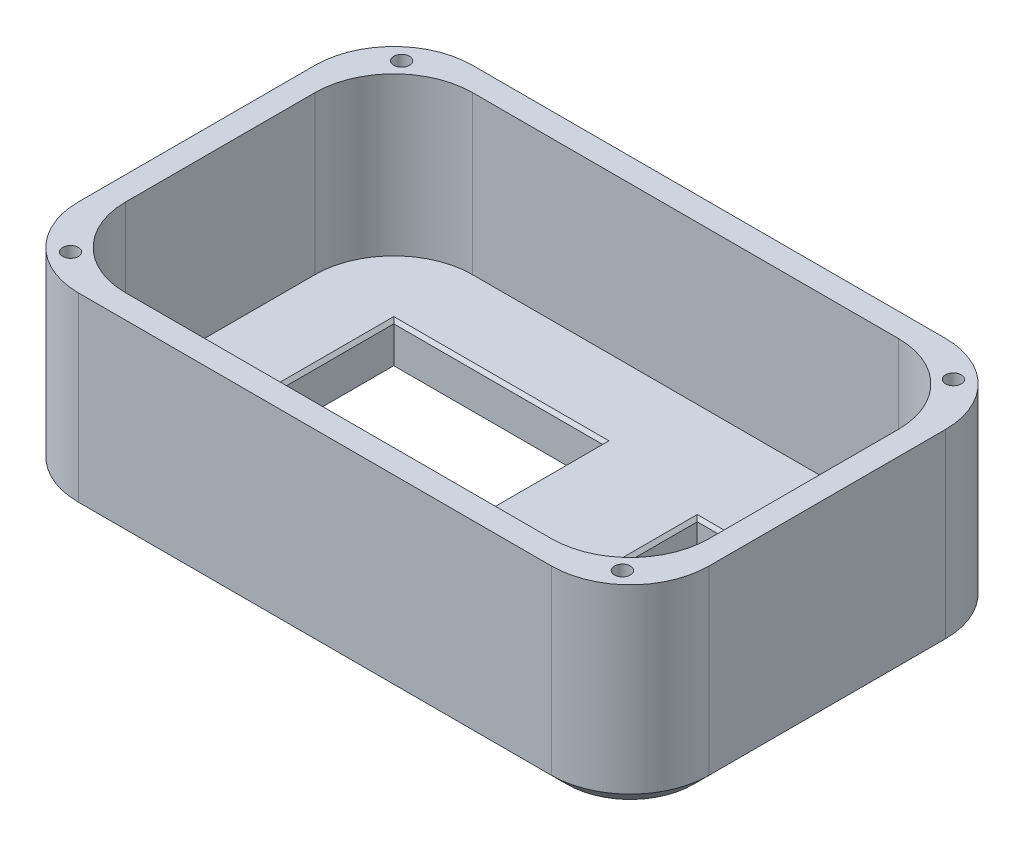
from build123d import *

# Parameters (mm, degrees)
SKETCH1_W           = 80
SKETCH1_H           = 50
BOSS_EXTRUDE1_DEPTH = 25
SKETCH2_W           = 74
SKETCH2_H           = 44
CUT_EXTRUDE1_DEPTH  = 20
SKETCH3_W           = 26.5
SKETCH3_H           = 21
CUT_EXTRUDE2_DEPTH  = 6
SKETCH4_W           = 13
SKETCH4_H           = 16.5
CUT_EXTRUDE3_DEPTH  = 6
FILLET1_R           = 10
SKETCH5_W           = 0.522382479
SKETCH5_H           = 4.253685898
CUT_EXTRUDE4_DEPTH  = 1
CHAMFER1_SIZE       = 2
FILLET2_R           = 10
CHAMFER2_SIZE       = 0.4
SKETCH6_R           = 1
CUT_EXTRUDE5_DEPTH  = 5


with BuildPart() as part:
    # Sketch1 → Boss-Extrude1 (new body)
    with BuildSketch(Plane(origin=(0, 0, 0), x_dir=(1, 0, 0), z_dir=(0, 1, 0))):
        Rectangle(SKETCH1_W, SKETCH1_H)
    extrude(amount=BOSS_EXTRUDE1_DEPTH)

    # Sketch2 → Cut-Extrude1 (cut)
    with BuildSketch(Plane(origin=(0, 25, 0), x_dir=(1, 0, 0), z_dir=(0, 1, 0))):
        Rectangle(SKETCH2_W, SKETCH2_H)
    extrude(amount=-CUT_EXTRUDE1_DEPTH, mode=Mode.SUBTRACT)

    # Sketch3 → Cut-Extrude2 (cut)
    with BuildSketch(Plane(origin=(0, 5, 0), x_dir=(1, 0, 0), z_dir=(0, 1, 0))):
        with Locations((-13.75, 1.5)):
            Rectangle(SKETCH3_W, SKETCH3_H)
    extrude(amount=-CUT_EXTRUDE2_DEPTH, mode=Mode.SUBTRACT)

    # Sketch4 → Cut-Extrude3 (cut)
    with BuildSketch(Plane(origin=(0, 5, 0), x_dir=(1, 0, 0), z_dir=(0, 1, 0))):
        with Locations((20.5, 1.25)):
            Rectangle(SKETCH4_W, SKETCH4_H)
    extrude(amount=-CUT_EXTRUDE3_DEPTH, mode=Mode.SUBTRACT)

    # Fillet1
    fillet1_edges = [part.edges().sort_by_distance(p)[0] for p in [
        (40, 12.5, 25),
        (-40, 12.5, 25),
        (-40, 12.5, -25),
        (40, 12.5, -25),
    ]]
    fillet(fillet1_edges, radius=FILLET1_R)

    # Sketch5 → Cut-Extrude4 (cut)
    # profile 1 of 15: a face of its own
    with BuildSketch(Plane.XZ):
        Polygon((-34.585413701, 19.199517843), (-34.04670677, 19.199517843), (-32.906327163, 14.927175428), (-31.213248237, 19.199517843), (-31.137456136, 19.199517843), (-29.473528018, 14.959824333), (-28.328484281, 19.199517843), (-27.794441479, 19.199517843), (-29.36392098, 13.378684509), (-29.438547048, 13.378684509), (-31.18992759, 17.828263836), (-32.95996465, 13.378684509), (-33.03575675, 13.378684509), align=None)
    # profile 2 of 15: a face of its own
    with BuildSketch(Plane.XZ):
        with BuildLine():
            Line((-23.407827897, 14.72195374), (-22.943747035, 14.478252986))
            add(Edge.make_bspline(
                [(-22.943747035, 14.478252986), (-22.98072861, 14.412654969), (-23.052680112, 14.285027207), (-23.176415641, 14.109683981), (-23.306123886, 13.951943197), (-23.44765989, 13.816018998), (-23.596789106, 13.697521159), (-23.754338533, 13.59384742), (-23.921128388, 13.505506261), (-24.097166561, 13.431078545), (-24.28393141, 13.37385228), (-24.481875527, 13.333432045), (-24.691378121, 13.308446919), (-24.834980042, 13.305544584), (-24.908511491, 13.304058441)],
                knots=[0, 0, 0, 0, 1.120438281, 2.179929193, 3.190490725, 4.156257408, 5.095198341, 6.022838206, 6.959905092, 7.901321166, 8.864066838, 9.862729781, 10.905609505, 12, 12, 12, 12], degree=3))
            add(Edge.make_bspline(
                [(-24.908511491, 13.304058441), (-24.99023928, 13.305966303), (-25.149666519, 13.309687989), (-25.381734408, 13.341773194), (-25.600230893, 13.394114724), (-25.80514369, 13.467233607), (-25.995970984, 13.562740716), (-26.173092049, 13.679089997), (-26.337438332, 13.815683759), (-26.483830975, 13.973705154), (-26.615621099, 14.142811933), (-26.731914397, 14.319026659), (-26.829134672, 14.501905974), (-26.908219192, 14.690285644), (-26.97209014, 14.882978333), (-27.016605718, 15.081737286), (-27.042266858, 15.286024561), (-27.046199156, 15.424223344), (-27.048180795, 15.493867135)],
                knots=[0, 0, 0, 0, 1.145258523, 2.234067595, 3.276747158, 4.290159414, 5.277019952, 6.260822364, 7.254936242, 8.264827045, 9.274100331, 10.257902744, 11.220704747, 12.172965371, 13.118907548, 14.062713208, 15.023725156, 16, 16, 16, 16], degree=3))
            add(Edge.make_bspline(
                [(-27.048180795, 15.493867135), (-27.046419342, 15.55921818), (-27.042928375, 15.688735322), (-27.020924316, 15.8804329), (-26.981927571, 16.066746886), (-26.92841528, 16.247832093), (-26.859311601, 16.423385323), (-26.774772779, 16.593513419), (-26.674667122, 16.758035348), (-26.59737864, 16.861817703), (-26.558447222, 16.914094499)],
                knots=[0, 0, 0, 0, 1.024358464, 2.0301432, 3.019427413, 4.004406732, 4.986367066, 5.972626655, 6.978780325, 8, 8, 8, 8], degree=3))
            add(Edge.make_bspline(
                [(-26.558447222, 16.914094499), (-26.505714325, 16.977074036), (-26.401918977, 17.101038079), (-26.226368705, 17.263918843), (-26.036276593, 17.400365454), (-25.834024877, 17.513467799), (-25.617262907, 17.599405995), (-25.388904479, 17.663447772), (-25.146349379, 17.699334059), (-24.980530101, 17.704402897), (-24.895685136, 17.706996475)],
                knots=[0, 0, 0, 0, 1.030682036, 2.02871468, 2.997146059, 3.962720338, 4.930598197, 5.918074684, 6.934738563, 8, 8, 8, 8], degree=3))
            add(Edge.make_bspline(
                [(-24.895685136, 17.706996475), (-24.808459773, 17.704744563), (-24.637343495, 17.700326824), (-24.387825789, 17.659370887), (-24.151731597, 17.594422769), (-23.929155397, 17.502696763), (-23.720074621, 17.384351651), (-23.525848298, 17.237763374), (-23.343154771, 17.067432341), (-23.236868718, 16.936441622), (-23.18278366, 16.869785271)],
                knots=[0, 0, 0, 0, 1.056321875, 2.072262726, 3.055038591, 4.01806755, 4.982017516, 5.957941055, 6.960871419, 8, 8, 8, 8], degree=3))
            add(Edge.make_bspline(
                [(-23.18278366, 16.869785271), (-23.145984454, 16.819553838), (-23.072630989, 16.719425329), (-22.9807498, 16.556157345), (-22.900992085, 16.385339845), (-22.83724072, 16.204211648), (-22.785619073, 16.014918846), (-22.748271245, 15.81610821), (-22.726368915, 15.60783894), (-22.722063665, 15.465932752), (-22.71986883, 15.393588356)],
                knots=[0, 0, 0, 0, 0.94817472, 1.890038105, 2.849395472, 3.817997239, 4.812318967, 5.836947057, 6.897266129, 8, 8, 8, 8], degree=3))
            Line((-22.71986883, 15.393588356), (-26.525798317, 15.393588356))
            add(Edge.make_bspline(
                [(-26.525798317, 15.393588356), (-26.523237805, 15.337541274), (-26.518202661, 15.227326948), (-26.494727833, 15.066055301), (-26.457726004, 14.912429635), (-26.405722575, 14.767602243), (-26.342746404, 14.629681543), (-26.26560254, 14.499690631), (-26.173567591, 14.378221598), (-26.070911874, 14.264187918), (-25.956645431, 14.162638057), (-25.836432339, 14.071746948), (-25.708551017, 13.995567878), (-25.574009799, 13.93373418), (-25.433026247, 13.885327605), (-25.285555942, 13.852285527), (-25.131889074, 13.830154541), (-25.0271378, 13.827693716), (-24.973809301, 13.82644092)],
                knots=[0, 0, 0, 0, 1.094153842, 2.151609401, 3.174256925, 4.172055639, 5.149267565, 6.128595816, 7.11444997, 8.118368179, 9.117203808, 10.09244225, 11.054858984, 12.015122123, 12.976791628, 13.957293641, 14.960065497, 16, 16, 16, 16], degree=3))
            add(Edge.make_bspline(
                [(-24.973809301, 13.82644092), (-24.921669357, 13.827452176), (-24.818213705, 13.829458702), (-24.664143137, 13.848969987), (-24.512569422, 13.880519362), (-24.364119906, 13.923576881), (-24.22180744, 13.976092194), (-24.090014543, 14.039460875), (-23.968807803, 14.109559918), (-23.855522801, 14.189737199), (-23.745640446, 14.287873434), (-23.636637049, 14.410336651), (-23.519760282, 14.555171504), (-23.446601399, 14.664180188), (-23.407827897, 14.72195374)],
                knots=[0, 0, 0, 0, 0.99110716, 1.966546729, 2.947904876, 3.932708344, 4.903319531, 5.828989031, 6.710028674, 7.56322171, 8.463672341, 9.504779593, 10.677557249, 12, 12, 12, 12], degree=3))
        make_face()
        with BuildLine():
            add(Edge.make_bspline(
                [(-23.242251308, 15.915970834), (-23.26137129, 15.985260161), (-23.298171099, 16.118619811), (-23.375066577, 16.303291387), (-23.461666508, 16.467418765), (-23.564149316, 16.609745846), (-23.680264506, 16.736146926), (-23.814385126, 16.846607359), (-23.96478863, 16.945424239), (-24.130697581, 17.028832622), (-24.306389931, 17.099829923), (-24.490338562, 17.147436216), (-24.678031812, 17.180048753), (-24.804983, 17.183085745), (-24.868866392, 17.184613997)],
                knots=[0, 0, 0, 0, 1.154881502, 2.222775134, 3.210006277, 4.132804581, 5.035138423, 5.962687519, 6.919655026, 7.923214229, 8.944639381, 9.960483929, 10.97369054, 12, 12, 12, 12], degree=3))
            add(Edge.make_bspline(
                [(-24.868866392, 17.184613997), (-24.921003494, 17.183596729), (-25.024067583, 17.181585804), (-25.175909955, 17.162509886), (-25.321729645, 17.130977858), (-25.462602605, 17.087795663), (-25.596682788, 17.030238261), (-25.726728134, 16.96274449), (-25.84943196, 16.880352118), (-25.926169329, 16.817555546), (-25.964936772, 16.785830944)],
                knots=[0, 0, 0, 0, 1.04873581, 2.073130211, 3.073294108, 4.04793562, 5.032784715, 6.005352987, 6.992311501, 8, 8, 8, 8], degree=3))
            add(Edge.make_bspline(
                [(-25.964936772, 16.785830944), (-25.992699289, 16.760727659), (-26.048883859, 16.70992473), (-26.123956845, 16.622397347), (-26.195836608, 16.528014094), (-26.261252218, 16.423164048), (-26.32125268, 16.309041157), (-26.377398738, 16.186608018), (-26.427934235, 16.054935562), (-26.456366694, 15.963178541), (-26.470994798, 15.915970834)],
                knots=[0, 0, 0, 0, 0.879870761, 1.780643979, 2.707998968, 3.669668524, 4.684282772, 5.740141944, 6.837334558, 8, 8, 8, 8], degree=3))
            Line((-26.470994798, 15.915970834), (-23.242251308, 15.915970834))
        make_face(mode=Mode.SUBTRACT)
    # profile 3 of 15: a face of its own
    with BuildSketch(Plane.XZ):
        with BuildLine():
            Line((-17.346791906, 17.632370407), (-17.346791906, 13.378684509))
            Line((-17.346791906, 13.378684509), (-17.869174385, 13.378684509))
            Line((-17.869174385, 13.378684509), (-17.869174385, 14.114450902))
            add(Edge.make_bspline(
                [(-17.869174385, 14.114450902), (-17.928079207, 14.047861244), (-18.043032708, 13.917910689), (-18.235022282, 13.748138314), (-18.438532216, 13.60780913), (-18.65257477, 13.494469329), (-18.876956658, 13.409332064), (-19.111180484, 13.348818416), (-19.355341792, 13.30991224), (-19.522071006, 13.306027213), (-19.606562539, 13.304058441)],
                knots=[0, 0, 0, 0, 1.074387032, 2.096679803, 3.090159297, 4.057316773, 5.018401886, 5.985159533, 6.978961417, 8, 8, 8, 8], degree=3))
            add(Edge.make_bspline(
                [(-19.606562539, 13.304058441), (-19.681681148, 13.306098015), (-19.829818371, 13.310120145), (-20.047732206, 13.341323643), (-20.257435625, 13.391433736), (-20.459126789, 13.461118906), (-20.651500584, 13.553555106), (-20.836204102, 13.664219538), (-21.012280472, 13.796004586), (-21.177045876, 13.946661104), (-21.328773382, 14.110301339), (-21.461922903, 14.284835778), (-21.572939632, 14.469509705), (-21.665773743, 14.661984962), (-21.737280758, 14.863743227), (-21.787129767, 15.074086803), (-21.818296914, 15.292766985), (-21.822317382, 15.44167974), (-21.824356009, 15.517187781)],
                knots=[0, 0, 0, 0, 1.033919861, 2.038935746, 3.024066025, 3.998881131, 4.97069526, 5.957263378, 6.95902576, 7.993208707, 9.027059324, 10.027763471, 11.009749337, 11.988697705, 12.965288445, 13.950418724, 14.960734635, 16, 16, 16, 16], degree=3))
            add(Edge.make_bspline(
                [(-21.824356009, 15.517187781), (-21.822272198, 15.591135155), (-21.818152617, 15.737325124), (-21.787463155, 15.952327911), (-21.735855632, 16.159413637), (-21.663431414, 16.357915601), (-21.570560925, 16.548073994), (-21.457590047, 16.730023307), (-21.324510621, 16.904264793), (-21.171086083, 17.066701345), (-21.004885042, 17.216746819), (-20.827085641, 17.347148529), (-20.642110731, 17.459768098), (-20.447091177, 17.548998939), (-20.244913504, 17.621192414), (-20.033777833, 17.6711401), (-19.814562624, 17.700572431), (-19.665731413, 17.704834552), (-19.590238087, 17.706996475)],
                knots=[0, 0, 0, 0, 1.020392517, 2.01726096, 2.990465484, 3.961182959, 4.928053699, 5.906110375, 6.912531644, 7.948652711, 8.985773172, 9.998621852, 10.987621588, 11.969261332, 12.953316658, 13.946091881, 14.958173133, 16, 16, 16, 16], degree=3))
            add(Edge.make_bspline(
                [(-19.590238087, 17.706996475), (-19.50342475, 17.704605357), (-19.333187893, 17.699916488), (-19.084175954, 17.660895738), (-18.848607697, 17.594973192), (-18.624664686, 17.505303258), (-18.413151092, 17.386144598), (-18.216069343, 17.235834115), (-18.031356867, 17.055319784), (-17.924286311, 16.916666795), (-17.869174385, 16.845298592)],
                knots=[0, 0, 0, 0, 1.038897134, 2.037228247, 3.008116434, 3.962042015, 4.918381754, 5.904844433, 6.921570401, 8, 8, 8, 8], degree=3))
            Line((-17.869174385, 16.845298592), (-17.869174385, 17.632370407))
            Line((-17.869174385, 17.632370407), (-17.346791906, 17.632370407))
        make_face()
        with BuildLine():
            add(Edge.make_bspline(
                [(-19.583241893, 17.184613997), (-19.65960181, 17.181897101), (-19.81032414, 17.176534383), (-20.031588986, 17.134668463), (-20.243323319, 17.065010393), (-20.444468159, 16.969745136), (-20.631846133, 16.849954487), (-20.799309298, 16.70506333), (-20.948227338, 16.539024867), (-21.073472154, 16.352588381), (-21.175570397, 16.15272077), (-21.247361282, 15.943795365), (-21.294708352, 15.72958042), (-21.299545499, 15.584287954), (-21.30197353, 15.51135762)],
                knots=[0, 0, 0, 0, 1.031046209, 2.035121221, 3.029706178, 4.034933723, 5.034054252, 6.02443088, 7.017295772, 8.038157696, 9.050218397, 10.03989886, 11.016116709, 12, 12, 12, 12], degree=3))
            add(Edge.make_bspline(
                [(-21.30197353, 15.51135762), (-21.298872035, 15.43886312), (-21.292681202, 15.294158275), (-21.248192249, 15.079651292), (-21.173552745, 14.870676653), (-21.071701363, 14.669008072), (-20.944164202, 14.481769991), (-20.796333907, 14.312566477), (-20.62678088, 14.16706296), (-20.438971681, 14.0452619), (-20.238389139, 13.946868993), (-20.027452232, 13.878406614), (-19.8101262, 13.834205233), (-19.662356307, 13.829042193), (-19.587906022, 13.82644092)],
                knots=[0, 0, 0, 0, 0.979072187, 1.954306742, 2.945804271, 3.96968567, 4.997920485, 5.998718438, 6.996577872, 8.005894225, 9.015743152, 10.005417472, 10.995077863, 12, 12, 12, 12], degree=3))
            add(Edge.make_bspline(
                [(-19.587906022, 13.82644092), (-19.51232416, 13.829201598), (-19.361999332, 13.834692313), (-19.140078053, 13.876737465), (-18.924715597, 13.946202954), (-18.718845647, 14.042494716), (-18.527063938, 14.161834033), (-18.354937111, 14.301545826), (-18.20938972, 14.464035526), (-18.086000345, 14.642612794), (-17.989249086, 14.838379055), (-17.918773664, 15.046821751), (-17.877106632, 15.267948138), (-17.871855027, 15.419063502), (-17.869174385, 15.4961992)],
                knots=[0, 0, 0, 0, 1.01762866, 2.023962475, 3.030623092, 4.058876274, 5.077231937, 6.066672613, 7.034107872, 8.005628644, 8.981990164, 9.965428785, 10.961468474, 12, 12, 12, 12], degree=3))
            add(Edge.make_bspline(
                [(-17.869174385, 15.4961992), (-17.870770385, 15.554969377), (-17.873911818, 15.670647685), (-17.897911229, 15.840495473), (-17.936087458, 16.003035968), (-17.98988222, 16.158440059), (-18.060549272, 16.305848531), (-18.145779188, 16.446319808), (-18.247070751, 16.579123304), (-18.362793402, 16.702430292), (-18.489463387, 16.814899539), (-18.623499784, 16.915291021), (-18.766490629, 16.997761873), (-18.916031225, 17.066017416), (-19.072381027, 17.120332692), (-19.236812284, 17.156567702), (-19.407577219, 17.181448141), (-19.52407048, 17.1835476), (-19.583241893, 17.184613997)],
                knots=[0, 0, 0, 0, 1.050140795, 2.067009409, 3.05949893, 4.030605086, 5.00011959, 5.97591094, 6.962425594, 7.979863591, 8.993523472, 9.986985069, 10.967611495, 11.937549037, 12.921786183, 13.919465291, 14.943216303, 16, 16, 16, 16], degree=3))
        make_face(mode=Mode.SUBTRACT)
    # profile 4 of 15: a face of its own
    with BuildSketch(Plane.XZ):
        Polygon((-15.630392334, 19.34876998), (-15.108009855, 19.34876998), (-15.108009855, 17.632370407), (-14.361749171, 17.632370407), (-14.361749171, 17.109987928), (-15.108009855, 17.109987928), (-15.108009855, 13.378684509), (-15.630392334, 13.378684509), (-15.630392334, 17.109987928), (-16.376653018, 17.109987928), (-16.376653018, 17.632370407), (-15.630392334, 17.632370407), align=None)
    # profile 5 of 15: a face of its own
    with BuildSketch(Plane.XZ):
        with BuildLine():
            Line((-13.466236351, 19.34876998), (-12.943853872, 19.34876998))
            Line((-12.943853872, 19.34876998), (-12.943853872, 16.82897414))
            add(Edge.make_bspline(
                [(-12.943853872, 16.82897414), (-12.887778788, 16.899063595), (-12.778597727, 17.035531358), (-12.594832162, 17.213584314), (-12.406119294, 17.367917259), (-12.205941152, 17.490770865), (-11.997970227, 17.587823354), (-11.781329381, 17.656654952), (-11.555978361, 17.69898255), (-11.402931772, 17.704301823), (-11.325401014, 17.706996475)],
                knots=[0, 0, 0, 0, 1.125788106, 2.19196713, 3.20547328, 4.180437432, 5.132270164, 6.079753143, 7.027236121, 8, 8, 8, 8], degree=3))
            add(Edge.make_bspline(
                [(-11.325401014, 17.706996475), (-11.246686063, 17.704093658), (-11.092621917, 17.698412146), (-10.868301199, 17.653486321), (-10.658816268, 17.576722105), (-10.46478986, 17.471669326), (-10.290456406, 17.340828922), (-10.136038405, 17.189767449), (-10.009907934, 17.014686897), (-9.924093688, 16.852940485), (-9.868257913, 16.709018295), (-9.832914102, 16.585555905), (-9.802946459, 16.447981485), (-9.776836303, 16.296365853), (-9.75943437, 16.129981205), (-9.74545669, 15.949578189), (-9.735517278, 15.755167148), (-9.735132097, 15.620589067), (-9.734932932, 15.551002719)],
                knots=[0, 0, 0, 0, 1.235656852, 2.418478516, 3.575258207, 4.727955599, 5.870717718, 6.98870536, 8.107142894, 9.245821548, 9.854588956, 10.528768408, 11.260415777, 12.065282286, 12.943670737, 13.886611085, 14.907229059, 16, 16, 16, 16], degree=3))
            Line((-9.734932932, 15.551002719), (-9.734932932, 13.378684509))
            Line((-9.734932932, 13.378684509), (-10.257315411, 13.378684509))
            Line((-10.257315411, 13.378684509), (-10.257315411, 15.379595968))
            add(Edge.make_bspline(
                [(-10.257315411, 15.379595968), (-10.257631903, 15.437509384), (-10.258237299, 15.548287892), (-10.260238576, 15.706890813), (-10.264706007, 15.850742122), (-10.271925214, 15.979380796), (-10.279517755, 16.092986172), (-10.28996751, 16.19139327), (-10.302125125, 16.274737252), (-10.313049635, 16.324903902), (-10.317949091, 16.347402792)],
                knots=[0, 0, 0, 0, 1.430932559, 2.737130458, 3.918967929, 4.986496826, 5.920444988, 6.731744033, 7.431208747, 8, 8, 8, 8], degree=3))
            add(Edge.make_bspline(
                [(-10.317949091, 16.347402792), (-10.336948699, 16.413418133), (-10.373475334, 16.540332241), (-10.458372982, 16.712732702), (-10.564410289, 16.859724943), (-10.693877699, 16.979325253), (-10.844484884, 17.073143016), (-11.017213895, 17.138116458), (-11.210439066, 17.178442729), (-11.346565859, 17.182499523), (-11.417517568, 17.184613997)],
                knots=[0, 0, 0, 0, 1.090059168, 2.095632401, 3.037101401, 3.955032261, 4.878929692, 5.839099886, 6.873700383, 8, 8, 8, 8], degree=3))
            add(Edge.make_bspline(
                [(-11.417517568, 17.184613997), (-11.459540281, 17.183822652), (-11.542702145, 17.182256602), (-11.666018438, 17.166533868), (-11.785643321, 17.140841178), (-11.902728847, 17.106074939), (-12.014793523, 17.058767303), (-12.125103844, 17.004001262), (-12.230534451, 16.936964795), (-12.33295753, 16.861750036), (-12.428282047, 16.778479257), (-12.516970118, 16.690589738), (-12.596030905, 16.596999113), (-12.667658074, 16.49920892), (-12.729489104, 16.39587783), (-12.78346167, 16.288002291), (-12.829256156, 16.175440437), (-12.852011776, 16.097316436), (-12.863397642, 16.058226777)],
                knots=[0, 0, 0, 0, 1.024319606, 2.027102035, 3.025350316, 4.005802111, 5.00026367, 5.987881639, 7.005602596, 8.042517216, 9.083927026, 10.089214625, 11.084353441, 12.06828073, 13.041928858, 14.016821737, 15.00770877, 16, 16, 16, 16], degree=3))
            add(Edge.make_bspline(
                [(-12.863397642, 16.058226777), (-12.869949285, 16.029919315), (-12.884226121, 15.96823387), (-12.899717576, 15.866495143), (-12.913584126, 15.748271736), (-12.925306535, 15.613742964), (-12.932496239, 15.462415862), (-12.940243337, 15.295323089), (-12.943127168, 15.111417983), (-12.943604398, 14.98353343), (-12.943853872, 14.916681137)],
                knots=[0, 0, 0, 0, 0.607992626, 1.324890765, 2.152360218, 3.099583803, 4.150613268, 5.323148443, 6.60066238, 8, 8, 8, 8], degree=3))
            Line((-12.943853872, 14.916681137), (-12.943853872, 13.378684509))
            Line((-12.943853872, 13.378684509), (-13.466236351, 13.378684509))
            Line((-13.466236351, 13.378684509), (-13.466236351, 19.34876998))
        make_face()
    # profile 6 of 15: a face of its own
    with BuildSketch(Plane.XZ):
        with BuildLine():
            Line((-5.049815077, 14.72195374), (-4.585734214, 14.478252986))
            add(Edge.make_bspline(
                [(-4.585734214, 14.478252986), (-4.62271579, 14.412654969), (-4.694667291, 14.285027207), (-4.818402821, 14.109683981), (-4.948111065, 13.951943197), (-5.089647069, 13.816018998), (-5.238776285, 13.697521159), (-5.396325712, 13.59384742), (-5.563115567, 13.505506261), (-5.739153741, 13.431078545), (-5.925918589, 13.37385228), (-6.123862707, 13.333432045), (-6.333365301, 13.308446919), (-6.476967221, 13.305544584), (-6.550498671, 13.304058441)],
                knots=[0, 0, 0, 0, 1.120438281, 2.179929193, 3.190490725, 4.156257408, 5.095198341, 6.022838206, 6.959905092, 7.901321166, 8.864066838, 9.862729781, 10.905609505, 12, 12, 12, 12], degree=3))
            add(Edge.make_bspline(
                [(-6.550498671, 13.304058441), (-6.632226459, 13.305966303), (-6.791653699, 13.309687989), (-7.023721588, 13.341773194), (-7.242218073, 13.394114724), (-7.44713087, 13.467233607), (-7.637958164, 13.562740716), (-7.815079228, 13.679089997), (-7.979425511, 13.815683759), (-8.125818154, 13.973705154), (-8.257608278, 14.142811933), (-8.373901577, 14.319026659), (-8.471121852, 14.501905974), (-8.550206371, 14.690285644), (-8.614077319, 14.882978333), (-8.658592897, 15.081737286), (-8.684254037, 15.286024561), (-8.688186335, 15.424223344), (-8.690167975, 15.493867135)],
                knots=[0, 0, 0, 0, 1.145258523, 2.234067595, 3.276747158, 4.290159414, 5.277019952, 6.260822364, 7.254936242, 8.264827045, 9.274100331, 10.257902744, 11.220704747, 12.172965371, 13.118907548, 14.062713208, 15.023725156, 16, 16, 16, 16], degree=3))
            add(Edge.make_bspline(
                [(-8.690167975, 15.493867135), (-8.688406522, 15.55921818), (-8.684915555, 15.688735322), (-8.662911495, 15.8804329), (-8.623914751, 16.066746886), (-8.57040246, 16.247832093), (-8.50129878, 16.423385323), (-8.416759958, 16.593513419), (-8.316654301, 16.758035348), (-8.239365819, 16.861817703), (-8.200434401, 16.914094499)],
                knots=[0, 0, 0, 0, 1.024358464, 2.0301432, 3.019427413, 4.004406732, 4.986367066, 5.972626655, 6.978780325, 8, 8, 8, 8], degree=3))
            add(Edge.make_bspline(
                [(-8.200434401, 16.914094499), (-8.147701505, 16.977074036), (-8.043906157, 17.101038079), (-7.868355885, 17.263918843), (-7.678263773, 17.400365454), (-7.476012056, 17.513467799), (-7.259250087, 17.599405995), (-7.030891659, 17.663447772), (-6.788336559, 17.699334059), (-6.622517281, 17.704402897), (-6.537672315, 17.706996475)],
                knots=[0, 0, 0, 0, 1.030682036, 2.02871468, 2.997146059, 3.962720338, 4.930598197, 5.918074684, 6.934738563, 8, 8, 8, 8], degree=3))
            add(Edge.make_bspline(
                [(-6.537672315, 17.706996475), (-6.450446952, 17.704744563), (-6.279330674, 17.700326824), (-6.029812968, 17.659370887), (-5.793718777, 17.594422769), (-5.571142576, 17.502696763), (-5.362061801, 17.384351651), (-5.167835478, 17.237763374), (-4.98514195, 17.067432341), (-4.878855897, 16.936441622), (-4.824770839, 16.869785271)],
                knots=[0, 0, 0, 0, 1.056321875, 2.072262726, 3.055038591, 4.01806755, 4.982017516, 5.957941055, 6.960871419, 8, 8, 8, 8], degree=3))
            add(Edge.make_bspline(
                [(-4.824770839, 16.869785271), (-4.787971634, 16.819553838), (-4.714618169, 16.719425329), (-4.62273698, 16.556157345), (-4.542979265, 16.385339845), (-4.4792279, 16.204211648), (-4.427606253, 16.014918846), (-4.390258425, 15.81610821), (-4.368356095, 15.60783894), (-4.364050844, 15.465932752), (-4.361856009, 15.393588356)],
                knots=[0, 0, 0, 0, 0.94817472, 1.890038105, 2.849395472, 3.817997239, 4.812318967, 5.836947057, 6.897266129, 8, 8, 8, 8], degree=3))
            Line((-4.361856009, 15.393588356), (-8.167785496, 15.393588356))
            add(Edge.make_bspline(
                [(-8.167785496, 15.393588356), (-8.165224984, 15.337541274), (-8.16018984, 15.227326948), (-8.136715013, 15.066055301), (-8.099713183, 14.912429635), (-8.047709754, 14.767602243), (-7.984733584, 14.629681543), (-7.907589719, 14.499690631), (-7.815554771, 14.378221598), (-7.712899054, 14.264187918), (-7.598632611, 14.162638057), (-7.478419518, 14.071746948), (-7.350538196, 13.995567878), (-7.215996979, 13.93373418), (-7.075013427, 13.885327605), (-6.927543121, 13.852285527), (-6.773876254, 13.830154541), (-6.66912498, 13.827693716), (-6.61579648, 13.82644092)],
                knots=[0, 0, 0, 0, 1.094153842, 2.151609401, 3.174256925, 4.172055639, 5.149267565, 6.128595816, 7.11444997, 8.118368179, 9.117203808, 10.09244225, 11.054858984, 12.015122123, 12.976791628, 13.957293641, 14.960065497, 16, 16, 16, 16], degree=3))
            add(Edge.make_bspline(
                [(-6.61579648, 13.82644092), (-6.563656536, 13.827452176), (-6.460200885, 13.829458702), (-6.306130316, 13.848969987), (-6.154556602, 13.880519362), (-6.006107086, 13.923576881), (-5.863794619, 13.976092194), (-5.732001722, 14.039460875), (-5.610794983, 14.109559918), (-5.49750998, 14.189737199), (-5.387627626, 14.287873434), (-5.278624229, 14.410336651), (-5.161747461, 14.555171504), (-5.088588579, 14.664180188), (-5.049815077, 14.72195374)],
                knots=[0, 0, 0, 0, 0.99110716, 1.966546729, 2.947904876, 3.932708344, 4.903319531, 5.828989031, 6.710028674, 7.56322171, 8.463672341, 9.504779593, 10.677557249, 12, 12, 12, 12], degree=3))
        make_face()
        with BuildLine():
            add(Edge.make_bspline(
                [(-4.884238488, 15.915970834), (-4.903358469, 15.985260161), (-4.940158279, 16.118619811), (-5.017053756, 16.303291387), (-5.103653688, 16.467418765), (-5.206136496, 16.609745846), (-5.322251686, 16.736146926), (-5.456372305, 16.846607359), (-5.606775809, 16.945424239), (-5.772684761, 17.028832622), (-5.948377111, 17.099829923), (-6.132325742, 17.147436216), (-6.320018991, 17.180048753), (-6.446970179, 17.183085745), (-6.510853572, 17.184613997)],
                knots=[0, 0, 0, 0, 1.154881502, 2.222775134, 3.210006277, 4.132804581, 5.035138423, 5.962687519, 6.919655026, 7.923214229, 8.944639381, 9.960483929, 10.97369054, 12, 12, 12, 12], degree=3))
            add(Edge.make_bspline(
                [(-6.510853572, 17.184613997), (-6.562990674, 17.183596729), (-6.666054763, 17.181585804), (-6.817897135, 17.162509886), (-6.963716824, 17.130977858), (-7.104589785, 17.087795663), (-7.238669967, 17.030238261), (-7.368715314, 16.96274449), (-7.491419139, 16.880352118), (-7.568156508, 16.817555546), (-7.606923951, 16.785830944)],
                knots=[0, 0, 0, 0, 1.04873581, 2.073130211, 3.073294108, 4.04793562, 5.032784715, 6.005352987, 6.992311501, 8, 8, 8, 8], degree=3))
            add(Edge.make_bspline(
                [(-7.606923951, 16.785830944), (-7.634686469, 16.760727659), (-7.690871038, 16.70992473), (-7.765944025, 16.622397347), (-7.837823787, 16.528014094), (-7.903239398, 16.423164048), (-7.96323986, 16.309041157), (-8.019385917, 16.186608018), (-8.069921414, 16.054935562), (-8.098353874, 15.963178541), (-8.112981977, 15.915970834)],
                knots=[0, 0, 0, 0, 0.879870761, 1.780643979, 2.707998968, 3.669668524, 4.684282772, 5.740141944, 6.837334558, 8, 8, 8, 8], degree=3))
            Line((-8.112981977, 15.915970834), (-4.884238488, 15.915970834))
        make_face(mode=Mode.SUBTRACT)
    # profile 7 of 15: a face of its own
    with BuildSketch(Plane.XZ):
        with BuildLine():
            Line((-3.466343189, 17.632370407), (-2.94396071, 17.632370407))
            Line((-2.94396071, 17.632370407), (-2.94396071, 17.006211052))
            add(Edge.make_bspline(
                [(-2.94396071, 17.006211052), (-2.905395596, 17.064512233), (-2.831640114, 17.176012789), (-2.709048492, 17.323478281), (-2.583479262, 17.445574496), (-2.45433129, 17.542871419), (-2.320654854, 17.615736808), (-2.185383757, 17.669110582), (-2.046389791, 17.700671665), (-1.952987163, 17.704885381), (-1.906191947, 17.706996475)],
                knots=[0, 0, 0, 0, 1.2804753, 2.448899062, 3.506932113, 4.484331642, 5.4025378, 6.288909075, 7.142734305, 8, 8, 8, 8], degree=3))
            add(Edge.make_bspline(
                [(-1.906191947, 17.706996475), (-1.869892687, 17.705016516), (-1.795204601, 17.700942622), (-1.68214308, 17.672319381), (-1.565654148, 17.626620813), (-1.490578059, 17.583646061), (-1.451439342, 17.561242435)],
                knots=[0, 0, 0, 0, 0.901110191, 1.854092781, 2.881294221, 4, 4, 4, 4], degree=3))
            Line((-1.451439342, 17.561242435), (-1.738283293, 17.108821896))
            add(Edge.make_bspline(
                [(-1.738283293, 17.108821896), (-1.763411034, 17.1200316), (-1.811108297, 17.141309765), (-1.880882736, 17.16649237), (-1.945213483, 17.181320388), (-1.986198068, 17.183566759), (-2.005304694, 17.184613997)],
                knots=[0, 0, 0, 0, 1.180555205, 2.24091978, 3.179933427, 4, 4, 4, 4], degree=3))
            add(Edge.make_bspline(
                [(-2.005304694, 17.184613997), (-2.047224229, 17.181819934), (-2.13272793, 17.176120858), (-2.258265841, 17.131319055), (-2.38008292, 17.058932435), (-2.476827935, 16.978652979), (-2.551737491, 16.901239559), (-2.605189747, 16.833637394), (-2.654222363, 16.757835789), (-2.701072122, 16.675130588), (-2.743757614, 16.584109642), (-2.78359651, 16.485682322), (-2.819617262, 16.379734625), (-2.840156895, 16.305922267), (-2.850678124, 16.268112594)],
                knots=[0, 0, 0, 0, 1.125678352, 2.296057538, 3.5422874, 4.923748041, 5.663163013, 6.437101912, 7.23742474, 8.08941207, 8.991984279, 9.93940061, 10.944477711, 12, 12, 12, 12], degree=3))
            add(Edge.make_bspline(
                [(-2.850678124, 16.268112594), (-2.858548545, 16.234389724), (-2.875980929, 16.159696127), (-2.892930428, 16.034384355), (-2.909676995, 15.886329532), (-2.921479347, 15.715119543), (-2.932419258, 15.521181943), (-2.938589478, 15.304221281), (-2.943750296, 15.064014863), (-2.943888444, 14.896084897), (-2.94396071, 14.808240132)],
                knots=[0, 0, 0, 0, 0.566838948, 1.255505196, 2.06880316, 3.007127437, 4.065329342, 5.249902469, 6.561414163, 8, 8, 8, 8], degree=3))
            Line((-2.94396071, 14.808240132), (-2.94396071, 13.378684509))
            Line((-2.94396071, 13.378684509), (-3.466343189, 13.378684509))
            Line((-3.466343189, 13.378684509), (-3.466343189, 17.632370407))
        make_face()
    # profile 8 of 15: a face of its own
    with BuildSketch(Plane.XZ):
        Polygon((1.160473051, 13.378684509), (1.928888349, 19.199517843), (2.003514417, 19.199517843), (4.406707025, 14.423449467), (6.802903439, 19.199517843), (6.877529508, 19.199517843), (7.652941, 13.378684509), (7.130558521, 13.378684509), (6.570863008, 17.5635745), (4.470838803, 13.378684509), (4.351903506, 13.378684509), (2.242551042, 17.576400856), (1.686353626, 13.378684509), align=None)
    # profile 9 of 15: a face of its own
    with BuildSketch(Plane.XZ):
        with BuildLine():
            Line((13.026017923, 17.632370407), (13.026017923, 13.378684509))
            Line((13.026017923, 13.378684509), (12.503635444, 13.378684509))
            Line((12.503635444, 13.378684509), (12.503635444, 14.114450902))
            add(Edge.make_bspline(
                [(12.503635444, 14.114450902), (12.444730622, 14.047861244), (12.329777121, 13.917910689), (12.137787547, 13.748138314), (11.934277614, 13.60780913), (11.720235059, 13.494469329), (11.495853171, 13.409332064), (11.261629345, 13.348818416), (11.017468037, 13.30991224), (10.850738823, 13.306027213), (10.76624729, 13.304058441)],
                knots=[0, 0, 0, 0, 1.074387032, 2.096679803, 3.090159297, 4.057316773, 5.018401886, 5.985159533, 6.978961417, 8, 8, 8, 8], degree=3))
            add(Edge.make_bspline(
                [(10.76624729, 13.304058441), (10.691128681, 13.306098015), (10.542991458, 13.310120145), (10.325077624, 13.341323643), (10.115374204, 13.391433736), (9.91368304, 13.461118906), (9.721309245, 13.553555106), (9.536605727, 13.664219538), (9.360529357, 13.796004586), (9.195763953, 13.946661104), (9.044036447, 14.110301339), (8.910886926, 14.284835778), (8.799870197, 14.469509705), (8.707036087, 14.661984962), (8.635529071, 14.863743227), (8.585680062, 15.074086803), (8.554512915, 15.292766985), (8.550492447, 15.44167974), (8.54845382, 15.517187781)],
                knots=[0, 0, 0, 0, 1.033919861, 2.038935746, 3.024066025, 3.998881131, 4.97069526, 5.957263378, 6.95902576, 7.993208707, 9.027059324, 10.027763471, 11.009749337, 11.988697705, 12.965288445, 13.950418724, 14.960734635, 16, 16, 16, 16], degree=3))
            add(Edge.make_bspline(
                [(8.54845382, 15.517187781), (8.550537631, 15.591135155), (8.554657212, 15.737325124), (8.585346674, 15.952327911), (8.636954197, 16.159413637), (8.709378415, 16.357915601), (8.802248904, 16.548073994), (8.915219783, 16.730023307), (9.048299208, 16.904264793), (9.201723747, 17.066701345), (9.367924787, 17.216746819), (9.545724188, 17.347148529), (9.730699098, 17.459768098), (9.925718652, 17.548998939), (10.127896325, 17.621192414), (10.339031996, 17.6711401), (10.558247205, 17.700572431), (10.707078416, 17.704834552), (10.782571742, 17.706996475)],
                knots=[0, 0, 0, 0, 1.020392517, 2.01726096, 2.990465484, 3.961182959, 4.928053699, 5.906110375, 6.912531644, 7.948652711, 8.985773172, 9.998621852, 10.987621588, 11.969261332, 12.953316658, 13.946091881, 14.958173133, 16, 16, 16, 16], degree=3))
            add(Edge.make_bspline(
                [(10.782571742, 17.706996475), (10.869385079, 17.704605357), (11.039621936, 17.699916488), (11.288633875, 17.660895738), (11.524202132, 17.594973192), (11.748145143, 17.505303258), (11.959658737, 17.386144598), (12.156740486, 17.235834115), (12.341452962, 17.055319784), (12.448523519, 16.916666795), (12.503635444, 16.845298592)],
                knots=[0, 0, 0, 0, 1.038897134, 2.037228247, 3.008116434, 3.962042015, 4.918381754, 5.904844433, 6.921570401, 8, 8, 8, 8], degree=3))
            Line((12.503635444, 16.845298592), (12.503635444, 17.632370407))
            Line((12.503635444, 17.632370407), (13.026017923, 17.632370407))
        make_face()
        with BuildLine():
            add(Edge.make_bspline(
                [(10.789567936, 17.184613997), (10.713208019, 17.181897101), (10.562485689, 17.176534383), (10.341220843, 17.134668463), (10.12948651, 17.065010393), (9.92834167, 16.969745136), (9.740963696, 16.849954487), (9.573500531, 16.70506333), (9.424582491, 16.539024867), (9.299337675, 16.352588381), (9.197239432, 16.15272077), (9.125448547, 15.943795365), (9.078101477, 15.72958042), (9.07326433, 15.584287954), (9.070836299, 15.51135762)],
                knots=[0, 0, 0, 0, 1.031046209, 2.035121221, 3.029706178, 4.034933723, 5.034054252, 6.02443088, 7.017295772, 8.038157696, 9.050218397, 10.03989886, 11.016116709, 12, 12, 12, 12], degree=3))
            add(Edge.make_bspline(
                [(9.070836299, 15.51135762), (9.073937794, 15.43886312), (9.080128627, 15.294158275), (9.12461758, 15.079651292), (9.199257084, 14.870676653), (9.301108467, 14.669008072), (9.428645627, 14.481769991), (9.576475922, 14.312566477), (9.746028949, 14.16706296), (9.933838148, 14.0452619), (10.13442069, 13.946868993), (10.345357597, 13.878406614), (10.562683629, 13.834205233), (10.710453522, 13.829042193), (10.784903807, 13.82644092)],
                knots=[0, 0, 0, 0, 0.979072187, 1.954306742, 2.945804271, 3.96968567, 4.997920485, 5.998718438, 6.996577872, 8.005894225, 9.015743152, 10.005417472, 10.995077863, 12, 12, 12, 12], degree=3))
            add(Edge.make_bspline(
                [(10.784903807, 13.82644092), (10.860485669, 13.829201598), (11.010810497, 13.834692313), (11.232731776, 13.876737465), (11.448094232, 13.946202954), (11.653964183, 14.042494716), (11.845745891, 14.161834033), (12.017872719, 14.301545826), (12.163420109, 14.464035526), (12.286809484, 14.642612794), (12.383560743, 14.838379055), (12.454036165, 15.046821751), (12.495703197, 15.267948138), (12.500954802, 15.419063502), (12.503635444, 15.4961992)],
                knots=[0, 0, 0, 0, 1.01762866, 2.023962475, 3.030623092, 4.058876274, 5.077231937, 6.066672613, 7.034107872, 8.005628644, 8.981990164, 9.965428785, 10.961468474, 12, 12, 12, 12], degree=3))
            add(Edge.make_bspline(
                [(12.503635444, 15.4961992), (12.502039444, 15.554969377), (12.498898011, 15.670647685), (12.4748986, 15.840495473), (12.436722371, 16.003035968), (12.382927609, 16.158440059), (12.312260557, 16.305848531), (12.227030641, 16.446319808), (12.125739078, 16.579123304), (12.010016427, 16.702430292), (11.883346442, 16.814899539), (11.749310045, 16.915291021), (11.6063192, 16.997761873), (11.456778604, 17.066017416), (11.300428802, 17.120332692), (11.135997545, 17.156567702), (10.96523261, 17.181448141), (10.848739349, 17.1835476), (10.789567936, 17.184613997)],
                knots=[0, 0, 0, 0, 1.050140795, 2.067009409, 3.05949893, 4.030605086, 5.00011959, 5.97591094, 6.962425594, 7.979863591, 8.993523472, 9.986985069, 10.967611495, 11.937549037, 12.921786183, 13.919465291, 14.943216303, 16, 16, 16, 16], degree=3))
        make_face(mode=Mode.SUBTRACT)
    # profile 10 of 15: a face of its own
    with BuildSketch(Plane.XZ):
        with BuildLine():
            Line((18.399094846, 16.710038843), (17.961832726, 16.438353313))
            add(Edge.make_bspline(
                [(17.961832726, 16.438353313), (17.913885914, 16.497939344), (17.819510756, 16.61522433), (17.655630621, 16.766582516), (17.480986638, 16.896581751), (17.292594456, 17.002527156), (17.09071831, 17.084387116), (16.876154326, 17.142313065), (16.648933099, 17.178409288), (16.493158953, 17.182511872), (16.413341807, 17.184613997)],
                knots=[0, 0, 0, 0, 1.026593902, 2.0206758, 2.988051866, 3.946915611, 4.916868779, 5.907761954, 6.927957743, 8, 8, 8, 8], degree=3))
            add(Edge.make_bspline(
                [(16.413341807, 17.184613997), (16.349547209, 17.182856367), (16.223905482, 17.179394764), (16.039457986, 17.157757075), (15.863764692, 17.118438163), (15.69572437, 17.066631156), (15.536532197, 16.997196447), (15.385771087, 16.912694984), (15.24210379, 16.814489143), (15.109693566, 16.700715891), (14.988571991, 16.576983821), (14.883632488, 16.44434583), (14.792267136, 16.306774773), (14.720577825, 16.160835268), (14.661911857, 16.009866046), (14.623316871, 15.851017408), (14.59759761, 15.6863244), (14.594655048, 15.57403497), (14.593165358, 15.517187781)],
                knots=[0, 0, 0, 0, 1.112346261, 2.190735716, 3.231507886, 4.247384806, 5.251966152, 6.253067467, 7.256802811, 8.280671706, 9.291813951, 10.270744147, 11.225547591, 12.165006084, 13.100104208, 14.043489273, 15.009504848, 16, 16, 16, 16], degree=3))
            add(Edge.make_bspline(
                [(14.593165358, 15.517187781), (14.596124424, 15.44273232), (14.602002685, 15.294824619), (14.648072851, 15.076496633), (14.723484919, 14.865410448), (14.826693035, 14.663064749), (14.957207983, 14.475809945), (15.110499734, 14.307864843), (15.286653257, 14.162483663), (15.484116431, 14.041954951), (15.698252821, 13.945060748), (15.92674565, 13.876030101), (16.167727785, 13.834365619), (16.332718054, 13.829116985), (16.416839904, 13.82644092)],
                knots=[0, 0, 0, 0, 0.966302908, 1.919585723, 2.883856336, 3.870342332, 4.860282998, 5.839159637, 6.814385684, 7.815993281, 8.834850808, 9.858348828, 10.908058873, 12, 12, 12, 12], degree=3))
            add(Edge.make_bspline(
                [(16.416839904, 13.82644092), (16.493932991, 13.828602107), (16.645441364, 13.832849414), (16.866911241, 13.868654131), (17.077758307, 13.92726765), (17.277975068, 14.009004873), (17.467195668, 14.114657182), (17.644197522, 14.244975946), (17.812502657, 14.396212173), (17.911451795, 14.513157656), (17.961832726, 14.572701603)],
                knots=[0, 0, 0, 0, 1.039848629, 2.043578496, 3.018386758, 3.987534228, 4.954977003, 5.934852016, 6.948509513, 8, 8, 8, 8], degree=3))
            Line((17.961832726, 14.572701603), (18.399094846, 14.285857653))
            add(Edge.make_bspline(
                [(18.399094846, 14.285857653), (18.373171012, 14.247788194), (18.32140939, 14.171775634), (18.234882494, 14.06459893), (18.141549869, 13.964278228), (18.041775635, 13.870948), (17.936862582, 13.782374842), (17.823226761, 13.702793116), (17.7045323, 13.627729608), (17.579385784, 13.560186533), (17.449081111, 13.499473044), (17.313801636, 13.447266537), (17.174135209, 13.402412682), (17.029917617, 13.366760333), (16.880864538, 13.338303379), (16.727361456, 13.319421092), (16.569461238, 13.305325892), (16.462736838, 13.304484588), (16.408677678, 13.304058441)],
                knots=[0, 0, 0, 0, 0.954134338, 1.905101784, 2.851144739, 3.791306361, 4.734911809, 5.6936923, 6.663572882, 7.643865596, 8.638447847, 9.640600242, 10.646758161, 11.676244097, 12.717260333, 13.78922464, 14.880174919, 16, 16, 16, 16], degree=3))
            add(Edge.make_bspline(
                [(16.408677678, 13.304058441), (16.326170054, 13.305540724), (16.164454511, 13.30844601), (15.927758626, 13.340391534), (15.701554944, 13.388550808), (15.485920746, 13.457675256), (15.280822463, 13.546658793), (15.086451336, 13.655353566), (14.903450959, 13.784662198), (14.733631002, 13.932283137), (14.577663525, 14.092340488), (14.443740802, 14.265052792), (14.327581465, 14.444070106), (14.234302539, 14.633346187), (14.160050448, 14.830365384), (14.109318006, 15.036706009), (14.076505574, 15.250666961), (14.072708096, 15.396575099), (14.07078288, 15.470546489)],
                knots=[0, 0, 0, 0, 1.1129367, 2.181364009, 3.217532258, 4.231199276, 5.232079859, 6.230262199, 7.231623845, 8.250719726, 9.263571943, 10.242672461, 11.195837495, 12.138959767, 13.085126421, 14.0317438, 15.002148558, 16, 16, 16, 16], degree=3))
            add(Edge.make_bspline(
                [(14.07078288, 15.470546489), (14.071516332, 15.520736099), (14.072975288, 15.620571519), (14.089709233, 15.7687451), (14.111326931, 15.914945383), (14.147957829, 16.057319174), (14.190268023, 16.198025829), (14.244277925, 16.335369391), (14.307634195, 16.469988091), (14.379566303, 16.601535149), (14.460540323, 16.727846466), (14.550149945, 16.847179644), (14.645020109, 16.96096823), (14.749589072, 17.065283818), (14.859419305, 17.164298174), (14.977618105, 17.25536615), (15.103507515, 17.338755393), (15.235196922, 17.416007856), (15.372609686, 17.484792536), (15.514915208, 17.544054004), (15.661255996, 17.594699538), (15.81186614, 17.634794966), (15.965745978, 17.668418467), (16.124108132, 17.689569457), (16.286346768, 17.704514484), (16.396204225, 17.706162266), (16.451820874, 17.706996475)],
                knots=[0, 0, 0, 0, 0.990994727, 1.971252077, 2.943264845, 3.907940874, 4.872158414, 5.844625996, 6.82015047, 7.809835459, 8.804511986, 9.781214284, 10.756496977, 11.728388426, 12.696359165, 13.676225489, 14.672885716, 15.677705647, 16.690706858, 17.706033469, 18.721040654, 19.747369689, 20.783475414, 21.830280724, 22.901553713, 24, 24, 24, 24], degree=3))
            add(Edge.make_bspline(
                [(16.451820874, 17.706996475), (16.521471482, 17.705463283), (16.660424552, 17.702404561), (16.866549751, 17.676662088), (17.069638949, 17.637851405), (17.266128834, 17.580353497), (17.453637025, 17.51073025), (17.62915253, 17.432543629), (17.78854375, 17.341747604), (17.934775705, 17.242427366), (18.068121879, 17.130399764), (18.189951076, 17.004325574), (18.302761569, 16.864860937), (18.366718743, 16.76207212), (18.399094846, 16.710038843)],
                knots=[0, 0, 0, 0, 1.095225653, 2.184976855, 3.262915854, 4.344593502, 5.400796181, 6.407717688, 7.363229445, 8.282371371, 9.184954523, 10.097238608, 11.036792983, 12, 12, 12, 12], degree=3))
        make_face()
    # profile 11 of 15: a face of its own
    with BuildSketch(Plane.XZ):
        with BuildLine():
            Line((19.443859803, 19.34876998), (19.966242282, 19.34876998))
            Line((19.966242282, 19.34876998), (19.966242282, 16.82897414))
            add(Edge.make_bspline(
                [(19.966242282, 16.82897414), (20.022317365, 16.899063595), (20.131498427, 17.035531358), (20.315263992, 17.213584314), (20.503976859, 17.367917259), (20.704155001, 17.490770865), (20.912125926, 17.587823354), (21.128766773, 17.656654952), (21.354117793, 17.69898255), (21.507164382, 17.704301823), (21.584695139, 17.706996475)],
                knots=[0, 0, 0, 0, 1.125788106, 2.19196713, 3.20547328, 4.180437432, 5.132270164, 6.079753143, 7.027236121, 8, 8, 8, 8], degree=3))
            add(Edge.make_bspline(
                [(21.584695139, 17.706996475), (21.66341009, 17.704093658), (21.817474236, 17.698412146), (22.041794955, 17.653486321), (22.251279886, 17.576722105), (22.445306294, 17.471669326), (22.619639748, 17.340828922), (22.774057749, 17.189767449), (22.90018822, 17.014686897), (22.986002466, 16.852940485), (23.041838241, 16.709018295), (23.077182052, 16.585555905), (23.107149695, 16.447981485), (23.133259851, 16.296365853), (23.150661783, 16.129981205), (23.164639464, 15.949578189), (23.174578876, 15.755167148), (23.174964056, 15.620589067), (23.175163222, 15.551002719)],
                knots=[0, 0, 0, 0, 1.235656852, 2.418478516, 3.575258207, 4.727955599, 5.870717718, 6.98870536, 8.107142894, 9.245821548, 9.854588956, 10.528768408, 11.260415777, 12.065282286, 12.943670737, 13.886611085, 14.907229059, 16, 16, 16, 16], degree=3))
            Line((23.175163222, 15.551002719), (23.175163222, 13.378684509))
            Line((23.175163222, 13.378684509), (22.652780743, 13.378684509))
            Line((22.652780743, 13.378684509), (22.652780743, 15.379595968))
            add(Edge.make_bspline(
                [(22.652780743, 15.379595968), (22.652464251, 15.437509384), (22.651858855, 15.548287892), (22.649857578, 15.706890813), (22.645390146, 15.850742122), (22.63817094, 15.979380796), (22.630578399, 16.092986172), (22.620128644, 16.19139327), (22.607971028, 16.274737252), (22.597046519, 16.324903902), (22.592147063, 16.347402792)],
                knots=[0, 0, 0, 0, 1.430932559, 2.737130458, 3.918967929, 4.986496826, 5.920444988, 6.731744033, 7.431208747, 8, 8, 8, 8], degree=3))
            add(Edge.make_bspline(
                [(22.592147063, 16.347402792), (22.573147455, 16.413418133), (22.53662082, 16.540332241), (22.451723172, 16.712732702), (22.345685864, 16.859724943), (22.216218454, 16.979325253), (22.06561127, 17.073143016), (21.892882259, 17.138116458), (21.699657088, 17.178442729), (21.563530295, 17.182499523), (21.492578586, 17.184613997)],
                knots=[0, 0, 0, 0, 1.090059168, 2.095632401, 3.037101401, 3.955032261, 4.878929692, 5.839099886, 6.873700383, 8, 8, 8, 8], degree=3))
            add(Edge.make_bspline(
                [(21.492578586, 17.184613997), (21.450555873, 17.183822652), (21.367394009, 17.182256602), (21.244077716, 17.166533868), (21.124452833, 17.140841178), (21.007367307, 17.106074939), (20.895302631, 17.058767303), (20.78499231, 17.004001262), (20.679561703, 16.936964795), (20.577138624, 16.861750036), (20.481814107, 16.778479257), (20.393126036, 16.690589738), (20.314065248, 16.596999113), (20.24243808, 16.49920892), (20.18060705, 16.39587783), (20.126634484, 16.288002291), (20.080839998, 16.175440437), (20.058084378, 16.097316436), (20.046698512, 16.058226777)],
                knots=[0, 0, 0, 0, 1.024319606, 2.027102035, 3.025350316, 4.005802111, 5.00026367, 5.987881639, 7.005602596, 8.042517216, 9.083927026, 10.089214625, 11.084353441, 12.06828073, 13.041928858, 14.016821737, 15.00770877, 16, 16, 16, 16], degree=3))
            add(Edge.make_bspline(
                [(20.046698512, 16.058226777), (20.040146869, 16.029919315), (20.025870033, 15.96823387), (20.010378578, 15.866495143), (19.996512028, 15.748271736), (19.984789619, 15.613742964), (19.977599914, 15.462415862), (19.969852816, 15.295323089), (19.966968986, 15.111417983), (19.966491756, 14.98353343), (19.966242282, 14.916681137)],
                knots=[0, 0, 0, 0, 0.607992626, 1.324890765, 2.152360218, 3.099583803, 4.150613268, 5.323148443, 6.60066238, 8, 8, 8, 8], degree=3))
            Line((19.966242282, 14.916681137), (19.966242282, 13.378684509))
            Line((19.966242282, 13.378684509), (19.443859803, 13.378684509))
            Line((19.443859803, 13.378684509), (19.443859803, 19.34876998))
        make_face()
    # profile 12 of 15: a face of its own
    with BuildSketch(Plane.XZ):
        with BuildLine():
            add(Edge.make_bspline(
                [(24.553413422, 19.423396048), (24.585829337, 19.421892356), (24.649305923, 19.41894784), (24.741097584, 19.393732859), (24.824679781, 19.350991835), (24.898816796, 19.293648842), (24.962433327, 19.226211255), (25.006972199, 19.147611764), (25.035598053, 19.062696385), (25.039054888, 19.0034651), (25.040814931, 18.973307573)],
                knots=[0, 0, 0, 0, 1.055194115, 2.066272739, 3.074728998, 4.095836921, 5.109056067, 6.073838105, 7.019297344, 8, 8, 8, 8], degree=3))
            add(Edge.make_bspline(
                [(25.040814931, 18.973307573), (25.039015196, 18.943932899), (25.035457333, 18.885862644), (25.00699431, 18.802419381), (24.962053754, 18.724912019), (24.89885759, 18.657605374), (24.824668972, 18.600294081), (24.741100455, 18.557544652), (24.649305168, 18.5323319), (24.585829081, 18.529387076), (24.553413422, 18.527883227)],
                knots=[0, 0, 0, 0, 0.96129708, 1.900370562, 2.859976407, 3.87933698, 4.906634145, 5.921202961, 6.938410037, 8, 8, 8, 8], degree=3))
            add(Edge.make_bspline(
                [(24.553413422, 18.527883227), (24.521368445, 18.529329655), (24.458997085, 18.532144937), (24.368579848, 18.55803936), (24.285710325, 18.60030871), (24.211428721, 18.657230115), (24.149511364, 18.725325379), (24.104444268, 18.802372081), (24.07604698, 18.885874687), (24.072480258, 18.943936944), (24.070676042, 18.973307573)],
                knots=[0, 0, 0, 0, 1.054934014, 2.053291228, 3.073705704, 4.106921865, 5.123545215, 6.088680038, 7.033164197, 8, 8, 8, 8], degree=3))
            add(Edge.make_bspline(
                [(24.070676042, 18.973307573), (24.07244073, 19.003460903), (24.075906689, 19.062683945), (24.104465554, 19.147659851), (24.149135972, 19.225794562), (24.211469719, 19.294023875), (24.285699414, 19.350977295), (24.368582668, 19.393238177), (24.45899634, 19.419134797), (24.521368193, 19.421949776), (24.553413422, 19.423396048)],
                knots=[0, 0, 0, 0, 0.98631895, 1.937192651, 2.907499808, 3.917963147, 4.944918757, 5.95915025, 6.951458133, 8, 8, 8, 8], degree=3))
        make_face()
    # profile 13 of 15: a face of its own
    with BuildSketch(Plane.XZ):
        with Locations((24.555745487, 15.505527458)):
            Rectangle(SKETCH5_W, SKETCH5_H)
    # profile 14 of 15: a face of its own
    with BuildSketch(Plane.XZ):
        with BuildLine():
            Line((26.085579888, 17.632370407), (26.607962367, 17.632370407))
            Line((26.607962367, 17.632370407), (26.607962367, 16.865121141))
            add(Edge.make_bspline(
                [(26.607962367, 16.865121141), (26.663738648, 16.934709574), (26.771974468, 17.069748357), (26.952227937, 17.247234836), (27.142725352, 17.393496121), (27.342300112, 17.510085407), (27.551223142, 17.597974379), (27.768220932, 17.661447957), (27.994592651, 17.699507607), (28.148536125, 17.704480645), (28.226415225, 17.706996475)],
                knots=[0, 0, 0, 0, 1.12780773, 2.188550248, 3.19190651, 4.159438251, 5.104880172, 6.052711206, 7.014878035, 8, 8, 8, 8], degree=3))
            add(Edge.make_bspline(
                [(28.226415225, 17.706996475), (28.305130577, 17.704094049), (28.459195509, 17.698413301), (28.68351057, 17.65348197), (28.893016321, 17.576738016), (29.086965749, 17.471610323), (29.261802317, 17.340880272), (29.415347338, 17.188577699), (29.542346691, 17.01339376), (29.627492782, 16.850870845), (29.683581746, 16.706699124), (29.718893145, 16.583219707), (29.748880385, 16.445651544), (29.77487747, 16.294410346), (29.792468215, 16.128436451), (29.80634224, 15.94841023), (29.816285378, 15.754389996), (29.816679876, 15.620200451), (29.816883307, 15.551002719)],
                knots=[0, 0, 0, 0, 1.235846778, 2.418850247, 3.575807741, 4.728682307, 5.871620074, 6.994088408, 8.11269785, 9.256955736, 9.865816715, 10.540099792, 11.271859618, 12.076849838, 12.949306005, 13.892391288, 14.913166135, 16, 16, 16, 16], degree=3))
            Line((29.816883307, 15.551002719), (29.816883307, 13.378684509))
            Line((29.816883307, 13.378684509), (29.294500829, 13.378684509))
            Line((29.294500829, 13.378684509), (29.294500829, 15.379595968))
            add(Edge.make_bspline(
                [(29.294500829, 15.379595968), (29.294179505, 15.43750901), (29.293564868, 15.548286804), (29.291626287, 15.706894572), (29.286953311, 15.850729989), (29.280386891, 15.979449182), (29.270775812, 16.092928551), (29.260759603, 16.191399217), (29.248510945, 16.274736158), (29.237596195, 16.324903563), (29.232701116, 16.347402792)],
                knots=[0, 0, 0, 0, 1.430800155, 2.736877192, 3.918605307, 4.986035426, 5.920637409, 6.731861385, 7.431261377, 8, 8, 8, 8], degree=3))
            add(Edge.make_bspline(
                [(29.232701116, 16.347402792), (29.215029845, 16.413446275), (29.181018116, 16.540559545), (29.096975289, 16.712979867), (28.990846229, 16.859661853), (28.861294687, 16.979698616), (28.709572045, 17.073116067), (28.536099333, 17.137933465), (28.34255057, 17.178473522), (28.206418936, 17.182510074), (28.135464704, 17.184613997)],
                knots=[0, 0, 0, 0, 1.084156227, 2.086665306, 3.027808233, 3.945421172, 4.874247719, 5.839848303, 6.874090471, 8, 8, 8, 8], degree=3))
            add(Edge.make_bspline(
                [(28.135464704, 17.184613997), (28.09344214, 17.183822356), (28.010280571, 17.182255718), (27.886962106, 17.16653731), (27.767345356, 17.140828426), (27.650229842, 17.106121894), (27.537957951, 17.058453811), (27.426922576, 17.00435437), (27.321304779, 16.936918832), (27.218852463, 16.861762524), (27.123535806, 16.778476033), (27.0348457, 16.69059058), (26.955785445, 16.596998891), (26.884158136, 16.499208979), (26.822327143, 16.395877815), (26.768354567, 16.288002295), (26.722560084, 16.175440436), (26.699804463, 16.097316435), (26.688418597, 16.058226777)],
                knots=[0, 0, 0, 0, 1.023777757, 2.026029729, 3.023749952, 4.003683103, 4.997618607, 5.993177895, 7.010360494, 8.046726602, 9.087585522, 10.09234134, 11.086953743, 12.070360549, 13.043493632, 14.017870808, 15.008233677, 16, 16, 16, 16], degree=3))
            add(Edge.make_bspline(
                [(26.688418597, 16.058226777), (26.681866586, 16.029529731), (26.667603201, 15.967057763), (26.652197651, 15.864537223), (26.638215053, 15.745941943), (26.62651192, 15.611410316), (26.619351603, 15.460471326), (26.611544374, 15.293769581), (26.608702042, 15.110640363), (26.60821583, 14.983144667), (26.607962367, 14.916681137)],
                knots=[0, 0, 0, 0, 0.615963638, 1.340920617, 2.168419149, 3.115676021, 4.16674242, 5.331190069, 6.6087489, 8, 8, 8, 8], degree=3))
            Line((26.607962367, 14.916681137), (26.607962367, 13.378684509))
            Line((26.607962367, 13.378684509), (26.085579888, 13.378684509))
            Line((26.085579888, 13.378684509), (26.085579888, 17.632370407))
        make_face()
    # profile 15 of 15: a face of its own
    with BuildSketch(Plane.XZ):
        with BuildLine():
            Line((34.502001162, 14.72195374), (34.966082025, 14.478252986))
            add(Edge.make_bspline(
                [(34.966082025, 14.478252986), (34.92910045, 14.412654969), (34.857148948, 14.285027207), (34.733413419, 14.109683981), (34.603705174, 13.951943197), (34.46216917, 13.816018998), (34.313039954, 13.697521159), (34.155490527, 13.59384742), (33.988700672, 13.505506261), (33.812662499, 13.431078545), (33.62589765, 13.37385228), (33.427953533, 13.333432045), (33.218450939, 13.308446919), (33.074849018, 13.305544584), (33.001317569, 13.304058441)],
                knots=[0, 0, 0, 0, 1.120438281, 2.179929193, 3.190490725, 4.156257408, 5.095198341, 6.022838206, 6.959905092, 7.901321166, 8.864066838, 9.862729781, 10.905609505, 12, 12, 12, 12], degree=3))
            add(Edge.make_bspline(
                [(33.001317569, 13.304058441), (32.91958978, 13.305966303), (32.760162541, 13.309687989), (32.528094652, 13.341773194), (32.309598166, 13.394114724), (32.104685369, 13.467233607), (31.913858075, 13.562740716), (31.736737011, 13.679089997), (31.572390728, 13.815683759), (31.425998085, 13.973705154), (31.294207961, 14.142811933), (31.177914663, 14.319026659), (31.080694388, 14.501905974), (31.001609868, 14.690285644), (30.93773892, 14.882978333), (30.893223342, 15.081737286), (30.867562202, 15.286024561), (30.863629904, 15.424223344), (30.861648264, 15.493867135)],
                knots=[0, 0, 0, 0, 1.145258523, 2.234067595, 3.276747158, 4.290159414, 5.277019952, 6.260822364, 7.254936242, 8.264827045, 9.274100331, 10.257902744, 11.220704747, 12.172965371, 13.118907548, 14.062713208, 15.023725156, 16, 16, 16, 16], degree=3))
            add(Edge.make_bspline(
                [(30.861648264, 15.493867135), (30.863409717, 15.55921818), (30.866900684, 15.688735322), (30.888904744, 15.8804329), (30.927901488, 16.066746886), (30.98141378, 16.247832093), (31.050517459, 16.423385323), (31.135056281, 16.593513419), (31.235161938, 16.758035348), (31.31245042, 16.861817703), (31.351381838, 16.914094499)],
                knots=[0, 0, 0, 0, 1.024358464, 2.0301432, 3.019427413, 4.004406732, 4.986367066, 5.972626655, 6.978780325, 8, 8, 8, 8], degree=3))
            add(Edge.make_bspline(
                [(31.351381838, 16.914094499), (31.404114734, 16.977074036), (31.507910083, 17.101038079), (31.683460354, 17.263918843), (31.873552467, 17.400365454), (32.075804183, 17.513467799), (32.292566152, 17.599405995), (32.52092458, 17.663447772), (32.76347968, 17.699334059), (32.929298958, 17.704402897), (33.014143924, 17.706996475)],
                knots=[0, 0, 0, 0, 1.030682036, 2.02871468, 2.997146059, 3.962720338, 4.930598197, 5.918074684, 6.934738563, 8, 8, 8, 8], degree=3))
            add(Edge.make_bspline(
                [(33.014143924, 17.706996475), (33.101369287, 17.704744563), (33.272485565, 17.700326824), (33.522003271, 17.659370887), (33.758097463, 17.594422769), (33.980673663, 17.502696763), (34.189754439, 17.384351651), (34.383980762, 17.237763374), (34.566674289, 17.067432341), (34.672960342, 16.936441622), (34.7270454, 16.869785271)],
                knots=[0, 0, 0, 0, 1.056321875, 2.072262726, 3.055038591, 4.01806755, 4.982017516, 5.957941055, 6.960871419, 8, 8, 8, 8], degree=3))
            add(Edge.make_bspline(
                [(34.7270454, 16.869785271), (34.763844606, 16.819553838), (34.837198071, 16.719425329), (34.92907926, 16.556157345), (35.008836975, 16.385339845), (35.07258834, 16.204211648), (35.124209986, 16.014918846), (35.161557815, 15.81610821), (35.183460145, 15.60783894), (35.187765395, 15.465932752), (35.18996023, 15.393588356)],
                knots=[0, 0, 0, 0, 0.94817472, 1.890038105, 2.849395472, 3.817997239, 4.812318967, 5.836947057, 6.897266129, 8, 8, 8, 8], degree=3))
            Line((35.18996023, 15.393588356), (31.384030743, 15.393588356))
            add(Edge.make_bspline(
                [(31.384030743, 15.393588356), (31.386591255, 15.337541274), (31.391626399, 15.227326948), (31.415101226, 15.066055301), (31.452103056, 14.912429635), (31.504106485, 14.767602243), (31.567082655, 14.629681543), (31.64422652, 14.499690631), (31.736261469, 14.378221598), (31.838917185, 14.264187918), (31.953183628, 14.162638057), (32.073396721, 14.071746948), (32.201278043, 13.995567878), (32.33581926, 13.93373418), (32.476802813, 13.885327605), (32.624273118, 13.852285527), (32.777939985, 13.830154541), (32.88269126, 13.827693716), (32.936019759, 13.82644092)],
                knots=[0, 0, 0, 0, 1.094153842, 2.151609401, 3.174256925, 4.172055639, 5.149267565, 6.128595816, 7.11444997, 8.118368179, 9.117203808, 10.09244225, 11.054858984, 12.015122123, 12.976791628, 13.957293641, 14.960065497, 16, 16, 16, 16], degree=3))
            add(Edge.make_bspline(
                [(32.936019759, 13.82644092), (32.988159703, 13.827452176), (33.091615355, 13.829458702), (33.245685923, 13.848969987), (33.397259637, 13.880519362), (33.545709154, 13.923576881), (33.68802162, 13.976092194), (33.819814517, 14.039460875), (33.941021256, 14.109559918), (34.054306259, 14.189737199), (34.164188614, 14.287873434), (34.273192011, 14.410336651), (34.390068778, 14.555171504), (34.46322766, 14.664180188), (34.502001162, 14.72195374)],
                knots=[0, 0, 0, 0, 0.99110716, 1.966546729, 2.947904876, 3.932708344, 4.903319531, 5.828989031, 6.710028674, 7.56322171, 8.463672341, 9.504779593, 10.677557249, 12, 12, 12, 12], degree=3))
        make_face()
        with BuildLine():
            add(Edge.make_bspline(
                [(34.667577752, 15.915970834), (34.64845777, 15.985260161), (34.61165796, 16.118619811), (34.534762483, 16.303291387), (34.448162551, 16.467418765), (34.345679743, 16.609745846), (34.229564553, 16.736146926), (34.095443934, 16.846607359), (33.94504043, 16.945424239), (33.779131478, 17.028832622), (33.603439129, 17.099829923), (33.419490498, 17.147436216), (33.231797248, 17.180048753), (33.10484606, 17.183085745), (33.040962668, 17.184613997)],
                knots=[0, 0, 0, 0, 1.154881502, 2.222775134, 3.210006277, 4.132804581, 5.035138423, 5.962687519, 6.919655026, 7.923214229, 8.944639381, 9.960483929, 10.97369054, 12, 12, 12, 12], degree=3))
            add(Edge.make_bspline(
                [(33.040962668, 17.184613997), (32.988825566, 17.183596729), (32.885761476, 17.181585804), (32.733919105, 17.162509886), (32.588099415, 17.130977858), (32.447226454, 17.087795663), (32.313146272, 17.030238261), (32.183100925, 16.96274449), (32.0603971, 16.880352118), (31.983659731, 16.817555546), (31.944892288, 16.785830944)],
                knots=[0, 0, 0, 0, 1.04873581, 2.073130211, 3.073294108, 4.04793562, 5.032784715, 6.005352987, 6.992311501, 8, 8, 8, 8], degree=3))
            add(Edge.make_bspline(
                [(31.944892288, 16.785830944), (31.917129771, 16.760727659), (31.860945201, 16.70992473), (31.785872215, 16.622397347), (31.713992452, 16.528014094), (31.648576842, 16.423164048), (31.588576379, 16.309041157), (31.532430322, 16.186608018), (31.481894825, 16.054935562), (31.453462366, 15.963178541), (31.438834262, 15.915970834)],
                knots=[0, 0, 0, 0, 0.879870761, 1.780643979, 2.707998968, 3.669668524, 4.684282772, 5.740141944, 6.837334558, 8, 8, 8, 8], degree=3))
            Line((31.438834262, 15.915970834), (34.667577752, 15.915970834))
        make_face(mode=Mode.SUBTRACT)
    extrude(amount=-CUT_EXTRUDE4_DEPTH, mode=Mode.SUBTRACT)

    # Chamfer1
    chamfer1_edges = [part.edges().sort_by_distance(p)[0] for p in [
        (40, 0, 0),
        (0, 0, 25),
        (-40, 0, 0),
        (0, 0, -25),
        (-37.071067812, 0, 22.071067812),
        (-37.071067812, 0, -22.071067812),
        (37.071067812, 0, -22.071067812),
        (37.071067812, 0, 22.071067812),
    ]]
    chamfer(chamfer1_edges, length=CHAMFER1_SIZE)

    # Fillet2
    fillet2_edges = [part.edges().sort_by_distance(p)[0] for p in [
        (-37, 15, 22),
        (-37, 15, -22),
        (37, 15, -22),
        (37, 15, 22),
    ]]
    fillet(fillet2_edges, radius=FILLET2_R)

    # Chamfer2
    chamfer2_edges = [part.edges().sort_by_distance(p)[0] for p in [
        (-27, 5, -1.5),
        (-13.75, 5, 9),
        (-0.5, 5, -1.5),
        (-13.75, 5, -12),
        (14, 5, -1.25),
        (20.5, 5, 7),
        (27, 5, -1.25),
        (20.5, 5, -9.5),
    ]]
    chamfer(chamfer2_edges, length=CHAMFER2_SIZE)

    # Sketch6 → Cut-Extrude5 (cut)
    with BuildSketch(Plane(origin=(0, 25, 0), x_dir=(1, 0, 0), z_dir=(0, 1, 0))):
        with Locations(Location((-35, 21, 0), (0, 0, 270))):
            Circle(SKETCH6_R)
        with Locations(Location((-35, -21, 0), (0, 0, 90))):
            Circle(SKETCH6_R)
        with Locations(Location((35, -21, 0), (0, 0, 270))):
            Circle(SKETCH6_R)
        with Locations(Location((35, 21, 0), (0, 0, 90))):
            Circle(SKETCH6_R)
    extrude(amount=-CUT_EXTRUDE5_DEPTH, mode=Mode.SUBTRACT)


solid = part.part
